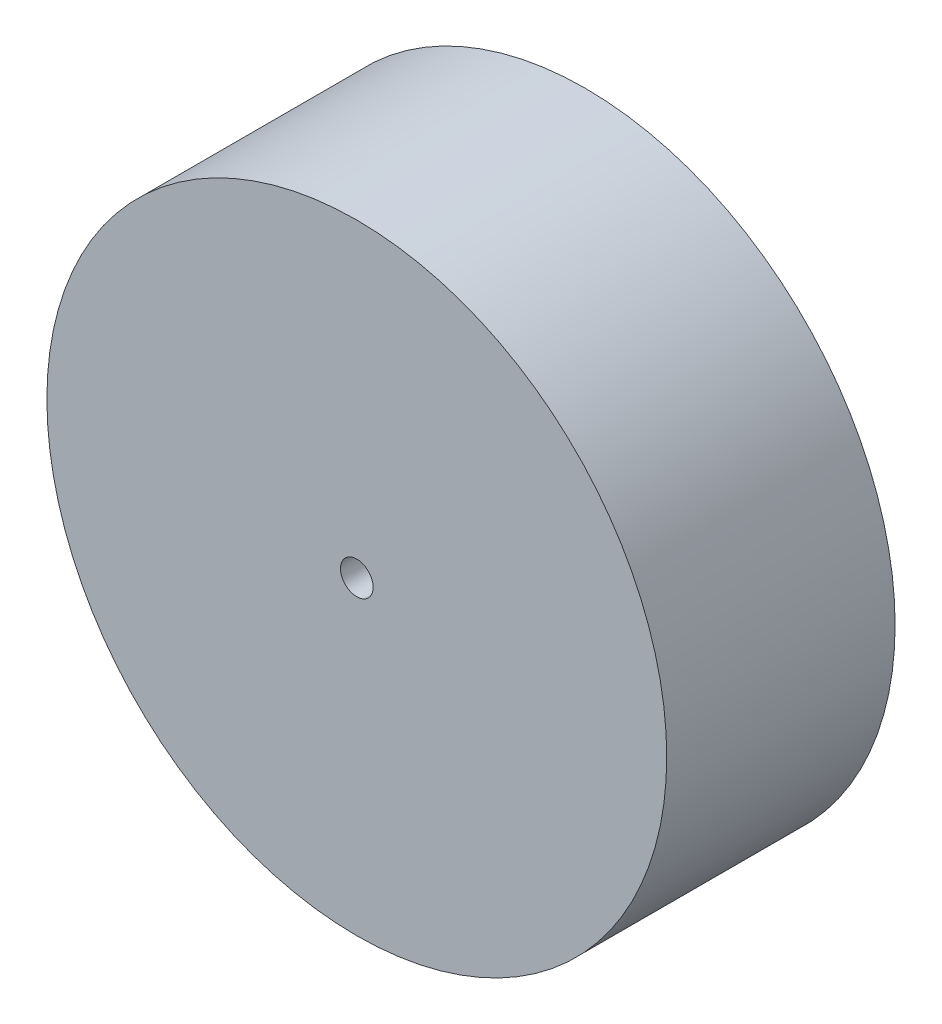
from build123d import *

# Parameters (mm, degrees)
SKETCH_2_R               = 19
EXTRUDE_1_DEPTH          = 14
CUT_EXTRUDE_3_DEPTH      = 31.298514815
CUT_EXTRUDE_3_DEPTH_BACK = 31.298514815
SKETCH_3_R               = 1


with BuildPart() as part:
    # ｽｹｯﾁ2 → ﾎﾞｽ - 押し出し1 (new body)
    with BuildSketch(Plane.XY):
        Circle(SKETCH_2_R)
    extrude(amount=EXTRUDE_1_DEPTH)

    # ｽｹｯﾁ3 → ｶｯﾄ - 押し出し3 (cut, two sides: drawn at the far end of the back side and taken through both)
    with BuildSketch(Plane.XY.offset(-CUT_EXTRUDE_3_DEPTH_BACK)):
        Circle(SKETCH_3_R)
    extrude(amount=CUT_EXTRUDE_3_DEPTH + CUT_EXTRUDE_3_DEPTH_BACK, mode=Mode.SUBTRACT)


solid = part.part
